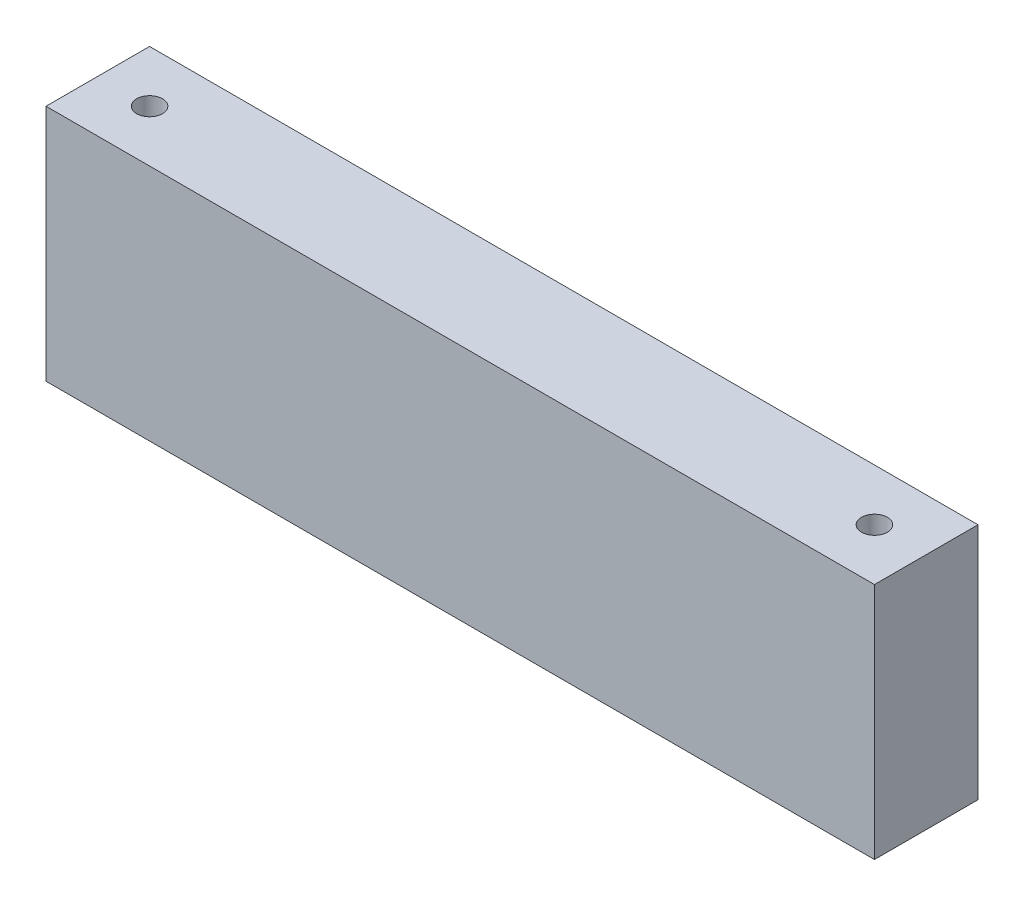
from build123d import *

# Parameters (mm, degrees)
SKETCH1_W           = 101.6
SKETCH1_H           = 29.21
BOSS_EXTRUDE1_DEPTH = 12.7
SKETCH2_R           = 1.5875
CUT_EXTRUDE1_DEPTH  = 60.959603901


with BuildPart() as part:
    # Sketch1 → Boss-Extrude1 (new body)
    with BuildSketch(Plane.XY):
        Rectangle(SKETCH1_W, SKETCH1_H)
    extrude(amount=BOSS_EXTRUDE1_DEPTH)

    # Sketch2 → Cut-Extrude1 (cut, through all)
    with BuildSketch(Plane(origin=(0, 14.605, 0), x_dir=(1, 0, 0), z_dir=(0, 1, 0))):
        with Locations(Location((-44.45, -6.35, 0), (0, 0, 270))):
            Circle(SKETCH2_R)
        with Locations(Location((44.45, -6.35, 0), (0, 0, 270))):
            Circle(SKETCH2_R)
    extrude(amount=-CUT_EXTRUDE1_DEPTH, mode=Mode.SUBTRACT)


solid = part.part
